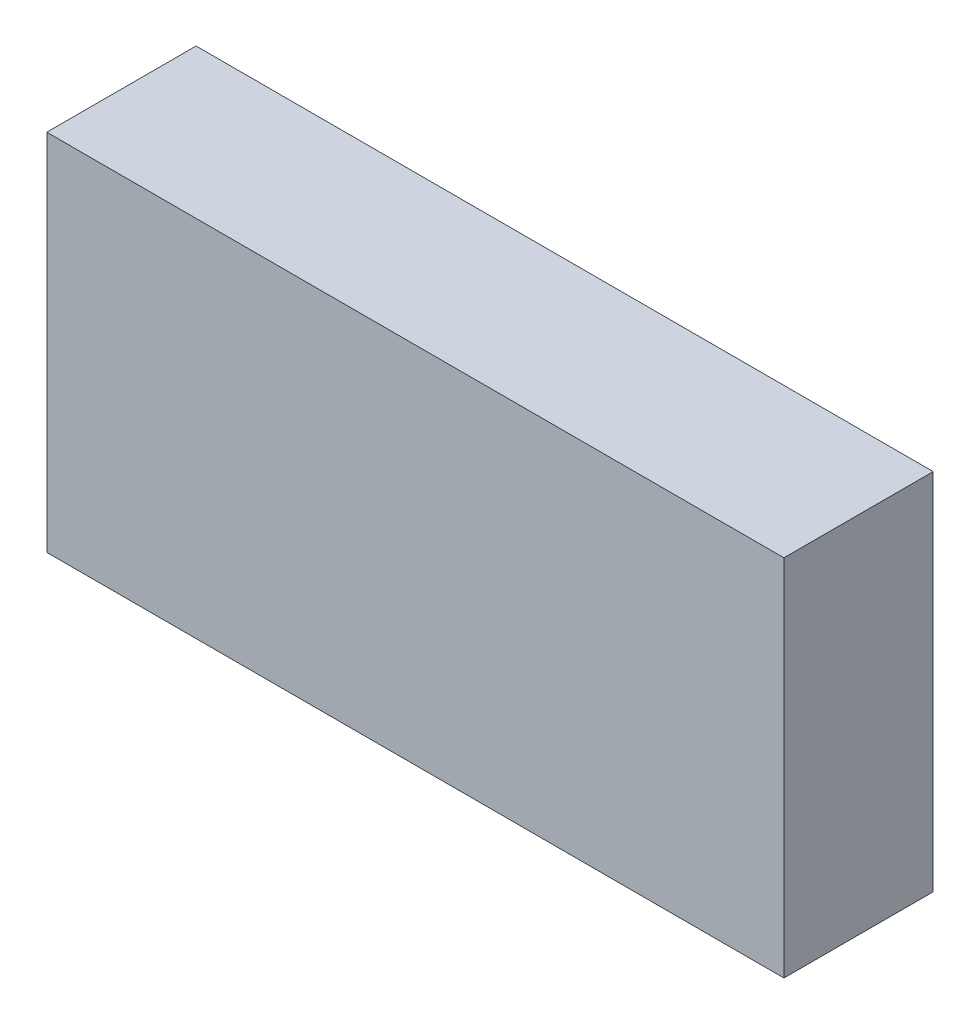
from build123d import *

# Parameters (mm, degrees)
SKETCH_1_W          = 15.8
SKETCH_1_H          = 7.8
EXTRUDE_1_DEPTH     = 3.2
SKETCH_2_R          = 2.5
CUT_EXTRUDE_1_DEPTH = 1.8


with BuildPart() as part:
    # Эскиз1 → Бобышка-Вытянуть1 (new body)
    with BuildSketch(Plane.XY):
        Rectangle(SKETCH_1_W, SKETCH_1_H)
    extrude(amount=EXTRUDE_1_DEPTH)

    # Эскиз2 → Вырез-Вытянуть1 (cut)
    with BuildSketch(Plane(origin=(0, 0, 0), x_dir=(-1, 0, 0), z_dir=(0, 0, -1))):
        with Locations((-4, 0)):
            Circle(SKETCH_2_R)
        with Locations((4, 0)):
            Circle(SKETCH_2_R)
    extrude(amount=-CUT_EXTRUDE_1_DEPTH, mode=Mode.SUBTRACT)


solid = part.part
